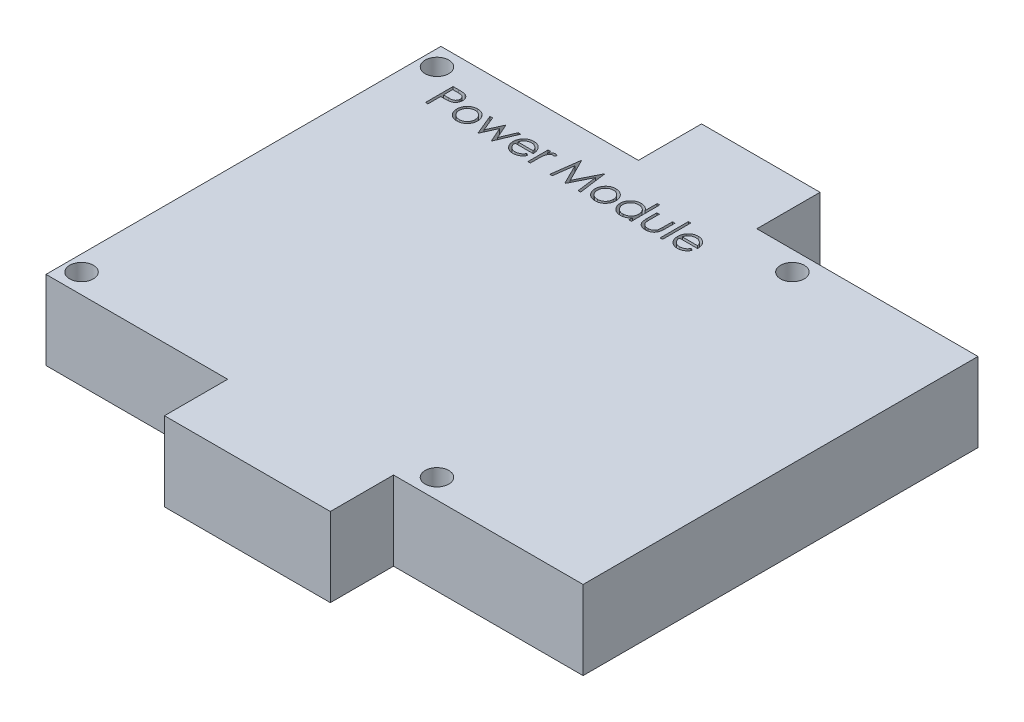
from build123d import *

# Parameters (mm, degrees)
SCHIZZO1_W                   = 68
SCHIZZO1_H                   = 50
ESTRUSIONE_ESTRUSIONE1_DEPTH = 10
SCHIZZO2_W                   = 0.314102564
SCHIZZO2_H                   = 3.589743589
TAGLIO_ESTRUSIONE1_DEPTH     = 3
SCHIZZO6_W                   = 21
SCHIZZO6_H                   = 10
ESTRUSIONE_ESTRUSIONE2_DEPTH = 8
SCHIZZO7_W                   = 15
SCHIZZO7_H                   = 10
ESTRUSIONE_ESTRUSIONE3_DEPTH = 8
SCHIZZO3_R                   = 1.5
TAGLIO_ESTRUSIONE2_DEPTH     = 49.42520019
SCHIZZO4_R                   = 1.5
TAGLIO_ESTRUSIONE3_DEPTH     = 49.42520019


with BuildPart() as part:
    # Schizzo1 → Estrusione-Estrusione1 (new body)
    with BuildSketch(Plane(origin=(0, 0, 0), x_dir=(1, 0, 0), z_dir=(0, 1, 0))):
        Rectangle(SCHIZZO1_W, SCHIZZO1_H)
    extrude(amount=ESTRUSIONE_ESTRUSIONE1_DEPTH)

    # Schizzo2 → Taglio-Estrusione1 (cut)
    # profile 1 of 11: a face of its own
    with BuildSketch(Plane(origin=(0, 10, 0), x_dir=(1, 0, 0), z_dir=(0, 1, 0))):
        with BuildLine():
            Line((-28.826759307, 21.36611206), (-28.14036107, 21.36611206))
            add(Edge.make_bspline(
                [(-28.14036107, 21.36611206), (-28.093150164, 21.366060163), (-28.002691971, 21.365960728), (-27.872976915, 21.362945982), (-27.755167184, 21.35891929), (-27.649516803, 21.353337397), (-27.555700705, 21.346740807), (-27.474143405, 21.337488767), (-27.404203849, 21.327828472), (-27.362297399, 21.318007065), (-27.343185589, 21.313527925)],
                knots=[0, 0, 0, 0, 1.415646017, 2.712440637, 3.8905458, 4.950247383, 5.884950622, 6.709939814, 7.411656543, 8, 8, 8, 8], degree=3))
            add(Edge.make_bspline(
                [(-27.343185589, 21.313527925), (-27.318992056, 21.306905975), (-27.271175078, 21.293818114), (-27.202274035, 21.26760439), (-27.13672019, 21.236522225), (-27.074288631, 21.201098285), (-27.015746548, 21.159812721), (-26.960220507, 21.114339103), (-26.908200527, 21.063627535), (-26.859979135, 21.008246795), (-26.815694337, 20.949126585), (-26.777564655, 20.885384355), (-26.745637428, 20.818093052), (-26.718254156, 20.74729948), (-26.698545702, 20.672409157), (-26.683698802, 20.593942445), (-26.674275174, 20.511907754), (-26.673372613, 20.455847887), (-26.672913153, 20.427309976)],
                knots=[0, 0, 0, 0, 0.999701418, 1.975846123, 2.934577507, 3.890451536, 4.834027766, 5.787354733, 6.749476667, 7.726910423, 8.712836071, 9.690891519, 10.682875813, 11.679750201, 12.712814741, 13.765529915, 14.8625177, 16, 16, 16, 16], degree=3))
            add(Edge.make_bspline(
                [(-26.672913153, 20.427309976), (-26.673334578, 20.3985322), (-26.674159124, 20.342226536), (-26.684055409, 20.259853747), (-26.697385601, 20.181135357), (-26.717882653, 20.106245907), (-26.744728326, 20.035630136), (-26.776220379, 19.968208904), (-26.81420391, 19.905129232), (-26.857848739, 19.846162115), (-26.906400334, 19.791252203), (-26.959653272, 19.740797408), (-27.017392564, 19.69509307), (-27.079434713, 19.654036726), (-27.146384561, 19.618580447), (-27.217226715, 19.586823142), (-27.292576931, 19.560152081), (-27.344719445, 19.54612202), (-27.371230461, 19.538988662)],
                knots=[0, 0, 0, 0, 1.121902311, 2.195077645, 3.232258892, 4.234102512, 5.217864754, 6.176164875, 7.132989551, 8.084763148, 9.034132444, 9.988522005, 10.94243251, 11.903244335, 12.886203696, 13.894208494, 14.929344452, 16, 16, 16, 16], degree=3))
            add(Edge.make_bspline(
                [(-27.371230461, 19.538988662), (-27.393157795, 19.534325681), (-27.441212822, 19.524106487), (-27.520355545, 19.51269803), (-27.612500931, 19.50296043), (-27.71752321, 19.495659292), (-27.835328115, 19.489408923), (-27.965979373, 19.48444083), (-28.10973345, 19.481710976), (-28.210004694, 19.481570183), (-28.262356262, 19.481496675)],
                knots=[0, 0, 0, 0, 0.601384939, 1.31797006, 2.144135048, 3.087295005, 4.142315834, 5.309527816, 6.595305764, 8, 8, 8, 8], degree=3))
            Line((-28.262356262, 19.481496675), (-28.512656743, 19.481496675))
            Line((-28.512656743, 19.481496675), (-28.512656743, 17.86611206))
            Line((-28.512656743, 17.86611206), (-28.826759307, 17.86611206))
            Line((-28.826759307, 17.86611206), (-28.826759307, 21.36611206))
        make_face()
        with BuildLine():
            Line((-28.512656743, 21.007137701), (-28.512656743, 19.840471034))
            Line((-28.512656743, 19.840471034), (-27.899876294, 19.832758694))
            add(Edge.make_bspline(
                [(-27.899876294, 19.832758694), (-27.869956369, 19.832743231), (-27.812196569, 19.832713379), (-27.728760345, 19.836698602), (-27.651351058, 19.841299135), (-27.580206483, 19.848035058), (-27.515294548, 19.857556316), (-27.456507019, 19.867168054), (-27.404299737, 19.881073416), (-27.343200535, 19.899796485), (-27.275117187, 19.931729101), (-27.201049639, 19.978078991), (-27.138279052, 20.037159699), (-27.083960756, 20.103587531), (-27.040854878, 20.17748666), (-27.009298885, 20.256555597), (-26.990757728, 20.339983446), (-26.988271534, 20.397071585), (-26.987015718, 20.425907733)],
                knots=[0, 0, 0, 0, 1.160613943, 2.240541288, 3.23993089, 4.169200891, 5.011653406, 5.7853311, 6.478053781, 7.106038997, 8.262395093, 9.384106736, 10.481365981, 11.59014053, 12.70357646, 13.786202915, 14.881775077, 16, 16, 16, 16], degree=3))
            add(Edge.make_bspline(
                [(-26.987015718, 20.425907733), (-26.988278364, 20.454046246), (-26.990788349, 20.509982128), (-27.009444212, 20.591960889), (-27.040793526, 20.670196593), (-27.084250121, 20.743169679), (-27.13699125, 20.809358483), (-27.198290594, 20.86685561), (-27.268003855, 20.913077313), (-27.332852086, 20.942910594), (-27.390453272, 20.96112587), (-27.440485232, 20.97387071), (-27.496975906, 20.984046316), (-27.559943686, 20.992285819), (-27.62890052, 20.99933928), (-27.704438835, 21.004125258), (-27.786272478, 21.006926714), (-27.843083049, 21.007065669), (-27.872532544, 21.007137701)],
                knots=[0, 0, 0, 0, 1.120700087, 2.227813068, 3.331159281, 4.466773991, 5.599788987, 6.693661531, 7.80175334, 8.91857717, 9.525282508, 10.207424825, 10.974604443, 11.810962634, 12.737642355, 13.736264703, 14.826523623, 16, 16, 16, 16], degree=3))
            Line((-27.872532544, 21.007137701), (-28.512656743, 21.007137701))
        make_face(mode=Mode.SUBTRACT)
    # profile 2 of 11: a face of its own
    with BuildSketch(Plane(origin=(0, 10, 0), x_dir=(1, 0, 0), z_dir=(0, 1, 0))):
        with BuildLine():
            add(Edge.make_bspline(
                [(-24.809331423, 20.468676162), (-24.76134015, 20.467654271), (-24.667240992, 20.465650592), (-24.529433106, 20.444235627), (-24.39788797, 20.411488262), (-24.272101778, 20.3662167), (-24.153685483, 20.30553475), (-24.040914239, 20.233125459), (-23.93409723, 20.147342865), (-23.870074201, 20.080984797), (-23.837576615, 20.047301964)],
                knots=[0, 0, 0, 0, 1.054011418, 2.066658804, 3.057071809, 4.030435133, 4.997543892, 5.974964718, 6.972108034, 8, 8, 8, 8], degree=3))
            add(Edge.make_bspline(
                [(-23.837576615, 20.047301964), (-23.809594661, 20.015087978), (-23.754172281, 19.951283436), (-23.683106562, 19.847827823), (-23.621885002, 19.740687722), (-23.572822041, 19.628440395), (-23.534137017, 19.512065724), (-23.506671321, 19.391163713), (-23.490334386, 19.266001366), (-23.488131419, 19.180997528), (-23.487015718, 19.137946996)],
                knots=[0, 0, 0, 0, 1.025258237, 2.030674902, 3.01204498, 3.988269485, 4.97094183, 5.956517959, 6.965070386, 8, 8, 8, 8], degree=3))
            add(Edge.make_bspline(
                [(-23.487015718, 19.137946996), (-23.487997055, 19.094646938), (-23.489936223, 19.009084005), (-23.50827984, 18.883064639), (-23.536810925, 18.760869816), (-23.577642764, 18.643011122), (-23.630000873, 18.529128295), (-23.69389156, 18.419718746), (-23.769763178, 18.314566612), (-23.855767174, 18.214564774), (-23.95081905, 18.122398559), (-24.053935199, 18.04207029), (-24.163089233, 17.973248765), (-24.279732586, 17.91781235), (-24.402800073, 17.87410265), (-24.532557141, 17.843402633), (-24.668802211, 17.824840949), (-24.761829432, 17.822457376), (-24.809331423, 17.821240265)],
                knots=[0, 0, 0, 0, 0.998656419, 1.973391657, 2.932242238, 3.890759089, 4.846373663, 5.82037756, 6.809684879, 7.83454468, 8.860553229, 9.859544525, 10.845671541, 11.83227036, 12.833544569, 13.85385346, 14.904124723, 16, 16, 16, 16], degree=3))
            add(Edge.make_bspline(
                [(-24.809331423, 17.821240265), (-24.857066142, 17.822461461), (-24.950557002, 17.824853236), (-25.087282984, 17.843330518), (-25.217272603, 17.874088501), (-25.340501201, 17.917955994), (-25.457646048, 17.973250537), (-25.567432545, 18.041862227), (-25.670632461, 18.122422382), (-25.765704445, 18.214558319), (-25.85170305, 18.314568276), (-25.927576059, 18.419718314), (-25.991466385, 18.529128407), (-26.043824589, 18.643011092), (-26.084656402, 18.760869824), (-26.113187494, 18.883064637), (-26.131531109, 19.009084005), (-26.133470278, 19.094646938), (-26.134451615, 19.137946996)],
                knots=[0, 0, 0, 0, 1.099876186, 2.154163076, 3.173186993, 4.173200201, 5.163417411, 6.152872554, 7.150605724, 8.17532212, 9.198891216, 10.186952605, 11.159729845, 12.11414092, 13.071450619, 14.029093627, 15.002601286, 16, 16, 16, 16], degree=3))
            add(Edge.make_bspline(
                [(-26.134451615, 19.137946996), (-26.133328305, 19.180763542), (-26.131104343, 19.265532944), (-26.114783834, 19.390460005), (-26.087425278, 19.511157394), (-26.048693881, 19.62708287), (-25.99917869, 19.738838306), (-25.938817402, 19.846243137), (-25.86702677, 19.949230937), (-25.811824818, 20.012953017), (-25.783890718, 20.045198598)],
                knots=[0, 0, 0, 0, 1.031353054, 2.041901799, 3.029428768, 4.008703097, 4.981709435, 5.96992636, 6.972712378, 8, 8, 8, 8], degree=3))
            add(Edge.make_bspline(
                [(-25.783890718, 20.045198598), (-25.751442127, 20.079173537), (-25.687626263, 20.145991234), (-25.580277535, 20.231523758), (-25.467783714, 20.305439832), (-25.348058788, 20.364916047), (-25.22237593, 20.411754565), (-25.090156687, 20.44432008), (-24.951881172, 20.465573435), (-24.857321551, 20.467631613), (-24.809331423, 20.468676162)],
                knots=[0, 0, 0, 0, 1.027980169, 2.021703884, 2.998553061, 3.971491411, 4.943284454, 5.930300938, 6.949603206, 8, 8, 8, 8], degree=3))
        make_face()
        with BuildLine():
            add(Edge.make_bspline(
                [(-24.810733666, 20.154573598), (-24.844671278, 20.153609007), (-24.911670406, 20.151704724), (-25.010289991, 20.137220819), (-25.105230145, 20.114273315), (-25.196670989, 20.081669259), (-25.284304161, 20.03957036), (-25.368213564, 19.987862), (-25.448646004, 19.927229043), (-25.524028067, 19.857766372), (-25.593210379, 19.781887377), (-25.653688356, 19.701039018), (-25.705113462, 19.616532672), (-25.747953621, 19.528280461), (-25.779860809, 19.435388047), (-25.803033832, 19.338907416), (-25.817504072, 19.238641999), (-25.819390451, 19.170480981), (-25.820349051, 19.13584363)],
                knots=[0, 0, 0, 0, 1.021534396, 2.016698045, 2.994645724, 3.958388632, 4.93408049, 5.916473867, 6.921342795, 7.962252576, 8.998418191, 10.008913653, 10.997312074, 11.973003931, 12.956656626, 13.948281152, 14.957379055, 16, 16, 16, 16], degree=3))
            add(Edge.make_bspline(
                [(-25.820349051, 19.13584363), (-25.818742227, 19.091091603), (-25.815552983, 19.002267198), (-25.789617746, 18.871456075), (-25.746231466, 18.745874223), (-25.687644187, 18.626257837), (-25.614237968, 18.515585559), (-25.527750901, 18.416914074), (-25.429111201, 18.331728263), (-25.319494701, 18.261047417), (-25.201140383, 18.204887662), (-25.075884062, 18.165088686), (-24.945243368, 18.139216994), (-24.855962637, 18.136645519), (-24.810733666, 18.135342829)],
                knots=[0, 0, 0, 0, 1.016792936, 2.018143844, 3.017858371, 4.030088057, 5.03801393, 6.028138512, 7.003788237, 7.991172063, 8.984598303, 9.972568034, 10.972917682, 12, 12, 12, 12], degree=3))
            add(Edge.make_bspline(
                [(-24.810733666, 18.135342829), (-24.765507297, 18.136653109), (-24.676231701, 18.139239566), (-24.545772525, 18.164958386), (-24.420858553, 18.205062047), (-24.302627165, 18.260984256), (-24.193060562, 18.331996671), (-24.09371144, 18.416433048), (-24.007962829, 18.5158469), (-23.934629224, 18.626404428), (-23.875082482, 18.74568878), (-23.83189928, 18.871479253), (-23.805901694, 19.002261295), (-23.802720865, 19.091089625), (-23.801118282, 19.13584363)],
                knots=[0, 0, 0, 0, 1.02726834, 2.027799167, 3.010890988, 4.004497153, 4.992059811, 5.971914811, 6.958719428, 7.966827853, 8.981595046, 9.981490638, 10.983022906, 12, 12, 12, 12], degree=3))
            add(Edge.make_bspline(
                [(-23.801118282, 19.13584363), (-23.802076552, 19.170481188), (-23.803962281, 19.238642614), (-23.818437245, 19.338905067), (-23.841592785, 19.435396664), (-23.873564402, 19.528248667), (-23.916218416, 19.616761171), (-23.968635209, 19.700790899), (-24.028866234, 19.782167445), (-24.098883355, 19.857521085), (-24.174186733, 19.927256122), (-24.254651771, 19.987885511), (-24.33843675, 20.039343107), (-24.425815333, 20.082029347), (-24.5172679, 20.113976688), (-24.612075029, 20.137353319), (-24.710273839, 20.151643516), (-24.777032883, 20.153590657), (-24.810733666, 20.154573598)],
                knots=[0, 0, 0, 0, 1.042956736, 2.052379634, 3.044323526, 4.02829302, 5.004299113, 5.996692471, 7.007513377, 8.048758398, 9.090003419, 10.095195979, 11.07790575, 12.047570684, 13.018257071, 13.989683339, 14.985167495, 16, 16, 16, 16], degree=3))
        make_face(mode=Mode.SUBTRACT)
    # profile 3 of 11: a face of its own
    with BuildSketch(Plane(origin=(0, 10, 0), x_dir=(1, 0, 0), z_dir=(0, 1, 0))):
        Polygon((-23.217784948, 20.423804367), (-22.880545365, 20.423804367), (-22.118425974, 18.584060778), (-21.283389916, 20.423804367), (-21.23010466, 20.423804367), (-20.413297769, 18.584060778), (-19.64416716, 20.423804367), (-19.313938794, 20.423804367), (-20.383149532, 17.86611206), (-20.448353859, 17.86611206), (-21.265861871, 19.705855649), (-22.100196807, 17.86611206), (-22.158389916, 17.86611206), align=None)
    # profile 4 of 11: a face of its own
    with BuildSketch(Plane(origin=(0, 10, 0), x_dir=(1, 0, 0), z_dir=(0, 1, 0))):
        with BuildLine():
            Line((-16.810933987, 18.673804367), (-16.531887512, 18.527269912))
            add(Edge.make_bspline(
                [(-16.531887512, 18.527269912), (-16.554124108, 18.487826581), (-16.597387716, 18.411085478), (-16.671788464, 18.305653618), (-16.749780537, 18.210805902), (-16.834884505, 18.129076248), (-16.924554184, 18.057824863), (-17.019286838, 17.995487038), (-17.119575656, 17.942368518), (-17.225425381, 17.89761599), (-17.337724932, 17.863206496), (-17.456746448, 17.838902275), (-17.582717944, 17.823879006), (-17.669064124, 17.822133865), (-17.713277737, 17.821240265)],
                knots=[0, 0, 0, 0, 1.120438281, 2.179929193, 3.190490725, 4.156257408, 5.095198341, 6.022838206, 6.959905092, 7.901321166, 8.864066838, 9.862729781, 10.905609505, 12, 12, 12, 12], degree=3))
            add(Edge.make_bspline(
                [(-17.713277737, 17.821240265), (-17.762419714, 17.82238744), (-17.858281476, 17.824625247), (-17.997821223, 17.843917711), (-18.129200641, 17.87539007), (-18.252412345, 17.919355612), (-18.367154597, 17.976782936), (-18.473655452, 18.046742417), (-18.572474978, 18.128874672), (-18.660499187, 18.223891116), (-18.73974307, 18.325573073), (-18.80966889, 18.431528957), (-18.868126321, 18.541492182), (-18.915678931, 18.654762706), (-18.954083796, 18.770626599), (-18.9808505, 18.890138067), (-18.996280248, 19.012973651), (-18.998644693, 19.096070987), (-18.99983623, 19.137946996)],
                knots=[0, 0, 0, 0, 1.145258523, 2.234067595, 3.276747158, 4.290159414, 5.277019952, 6.260822364, 7.254936242, 8.264827045, 9.274100331, 10.257902744, 11.220704747, 12.172965371, 13.118907548, 14.062713208, 15.023725156, 16, 16, 16, 16], degree=3))
            add(Edge.make_bspline(
                [(-18.99983623, 19.137946996), (-18.998777089, 19.177241826), (-18.996678011, 19.255118991), (-18.983447223, 19.370384535), (-18.95999893, 19.482412988), (-18.927822606, 19.591297436), (-18.88627136, 19.69685557), (-18.835439141, 19.799151633), (-18.775246763, 19.898076773), (-18.728774089, 19.960479907), (-18.705365077, 19.991913342)],
                knots=[0, 0, 0, 0, 1.024358464, 2.0301432, 3.019427413, 4.004406732, 4.986367066, 5.972626655, 6.978780325, 8, 8, 8, 8], degree=3))
            add(Edge.make_bspline(
                [(-18.705365077, 19.991913342), (-18.673657394, 20.029782212), (-18.611246447, 20.104320362), (-18.505690092, 20.202258688), (-18.391389895, 20.284302463), (-18.269778269, 20.352309599), (-18.139441795, 20.403983246), (-18.002132504, 20.442490829), (-17.856286918, 20.46406884), (-17.756581697, 20.467116673), (-17.705565397, 20.468676162)],
                knots=[0, 0, 0, 0, 1.030682036, 2.02871468, 2.997146059, 3.962720338, 4.930598197, 5.918074684, 6.934738563, 8, 8, 8, 8], degree=3))
            add(Edge.make_bspline(
                [(-17.705565397, 20.468676162), (-17.653117792, 20.467322113), (-17.550227546, 20.464665778), (-17.400195425, 20.440039445), (-17.258234708, 20.40098689), (-17.124402204, 20.3458331), (-16.998684343, 20.274673548), (-16.881898294, 20.186531706), (-16.772046781, 20.084113619), (-16.708138202, 20.00535041), (-16.67561748, 19.965270714)],
                knots=[0, 0, 0, 0, 1.056321875, 2.072262726, 3.055038591, 4.01806755, 4.982017516, 5.957941055, 6.960871419, 8, 8, 8, 8], degree=3))
            add(Edge.make_bspline(
                [(-16.67561748, 19.965270714), (-16.653490542, 19.935067132), (-16.609383949, 19.874861014), (-16.554136849, 19.776689856), (-16.506179454, 19.673979262), (-16.467846493, 19.565068965), (-16.436806992, 19.451249385), (-16.414350173, 19.33170684), (-16.401180554, 19.206476929), (-16.398591857, 19.121150373), (-16.397272128, 19.077650521)],
                knots=[0, 0, 0, 0, 0.94817472, 1.890038105, 2.849395472, 3.817997239, 4.812318967, 5.836947057, 6.897266129, 8, 8, 8, 8], degree=3))
            Line((-16.397272128, 19.077650521), (-18.685733666, 19.077650521))
            add(Edge.make_bspline(
                [(-18.685733666, 19.077650521), (-18.68419406, 19.043950057), (-18.681166486, 18.977679453), (-18.667051343, 18.88070867), (-18.644802569, 18.788335328), (-18.613533506, 18.701252286), (-18.575666661, 18.618322159), (-18.529280944, 18.540160122), (-18.47394139, 18.467122192), (-18.412215691, 18.398555054), (-18.343508596, 18.337494293), (-18.271225848, 18.282842517), (-18.194332283, 18.23703692), (-18.1134342, 18.19985703), (-18.028662415, 18.170750714), (-17.93999022, 18.150882893), (-17.847592103, 18.137575786), (-17.784606369, 18.136096121), (-17.752540557, 18.135342829)],
                knots=[0, 0, 0, 0, 1.094153842, 2.151609401, 3.174256925, 4.172055639, 5.149267565, 6.128595816, 7.11444997, 8.118368179, 9.117203808, 10.09244225, 11.054858984, 12.015122123, 12.976791628, 13.957293641, 14.960065497, 16, 16, 16, 16], degree=3))
            add(Edge.make_bspline(
                [(-17.752540557, 18.135342829), (-17.72118941, 18.135950886), (-17.658982719, 18.137157387), (-17.566341861, 18.148889298), (-17.475202334, 18.167859573), (-17.385941351, 18.193749563), (-17.300370505, 18.225326415), (-17.221124955, 18.263429273), (-17.148244739, 18.30557902), (-17.080127773, 18.353788695), (-17.014056779, 18.412796882), (-16.948514293, 18.486432603), (-16.878237639, 18.573520131), (-16.834248047, 18.639065797), (-16.810933987, 18.673804367)],
                knots=[0, 0, 0, 0, 0.99110716, 1.966546729, 2.947904876, 3.932708344, 4.903319531, 5.828989031, 6.710028674, 7.56322171, 8.463672341, 9.504779593, 10.677557249, 12, 12, 12, 12], degree=3))
        make_face()
        with BuildLine():
            add(Edge.make_bspline(
                [(-16.711374692, 19.391753085), (-16.722871316, 19.433415959), (-16.744998618, 19.51360358), (-16.791234982, 19.62464447), (-16.843306523, 19.723332371), (-16.904928254, 19.808912004), (-16.97474698, 19.884915517), (-17.055392163, 19.951334102), (-17.145828056, 20.010751553), (-17.245587197, 20.060904053), (-17.351228982, 20.103593912), (-17.461835174, 20.132219027), (-17.574692962, 20.15182857), (-17.651027248, 20.153654678), (-17.689439596, 20.154573598)],
                knots=[0, 0, 0, 0, 1.154881502, 2.222775134, 3.210006277, 4.132804581, 5.035138423, 5.962687519, 6.919655026, 7.923214229, 8.944639381, 9.960483929, 10.97369054, 12, 12, 12, 12], degree=3))
            add(Edge.make_bspline(
                [(-17.689439596, 20.154573598), (-17.720789034, 20.153961927), (-17.782760283, 20.152752781), (-17.874061351, 20.141282651), (-17.96174105, 20.122322806), (-18.046446338, 20.09635785), (-18.127067206, 20.061749247), (-18.205261975, 20.021166021), (-18.279042371, 19.971624437), (-18.325183666, 19.933865582), (-18.348494083, 19.914789944)],
                knots=[0, 0, 0, 0, 1.04873581, 2.073130211, 3.073294108, 4.04793562, 5.032784715, 6.005352987, 6.992311501, 8, 8, 8, 8], degree=3))
            add(Edge.make_bspline(
                [(-18.348494083, 19.914789944), (-18.365187365, 19.899695629), (-18.398970499, 19.869148413), (-18.444111021, 19.816519206), (-18.487331493, 19.759767644), (-18.526665146, 19.696722519), (-18.562742732, 19.62810174), (-18.59650271, 19.554484105), (-18.626889122, 19.475310975), (-18.643985232, 19.420138536), (-18.652780942, 19.391753085)],
                knots=[0, 0, 0, 0, 0.879870761, 1.780643979, 2.707998968, 3.669668524, 4.684282772, 5.740141944, 6.837334558, 8, 8, 8, 8], degree=3))
            Line((-18.652780942, 19.391753085), (-16.711374692, 19.391753085))
        make_face(mode=Mode.SUBTRACT)
    # profile 5 of 11: a face of its own
    with BuildSketch(Plane(origin=(0, 10, 0), x_dir=(1, 0, 0), z_dir=(0, 1, 0))):
        with BuildLine():
            Line((-15.858810589, 20.423804367), (-15.544708025, 20.423804367))
            Line((-15.544708025, 20.423804367), (-15.544708025, 20.047301964))
            add(Edge.make_bspline(
                [(-15.544708025, 20.047301964), (-15.521519266, 20.082357792), (-15.477170946, 20.149401791), (-15.403458016, 20.238071092), (-15.327954685, 20.311486139), (-15.250299498, 20.369989658), (-15.169921398, 20.413802776), (-15.088584446, 20.445895811), (-15.005008976, 20.464873127), (-14.948847052, 20.467406786), (-14.920709628, 20.468676162)],
                knots=[0, 0, 0, 0, 1.2804753, 2.448899062, 3.506932113, 4.484331642, 5.4025378, 6.288909075, 7.142734305, 8, 8, 8, 8], degree=3))
            add(Edge.make_bspline(
                [(-14.920709628, 20.468676162), (-14.898883301, 20.467485636), (-14.853974216, 20.46503605), (-14.785991626, 20.447825225), (-14.715948174, 20.420347203), (-14.670805787, 20.39450698), (-14.647272128, 20.381035938)],
                knots=[0, 0, 0, 0, 0.901110191, 1.854092781, 2.881294221, 4, 4, 4, 4], degree=3))
            Line((-14.647272128, 20.381035938), (-14.819748089, 20.109000682))
            add(Edge.make_bspline(
                [(-14.819748089, 20.109000682), (-14.83485711, 20.115740948), (-14.863536925, 20.128535263), (-14.905491491, 20.143677273), (-14.944172828, 20.152593189), (-14.968816386, 20.153943906), (-14.98030498, 20.154573598)],
                knots=[0, 0, 0, 0, 1.180555205, 2.24091978, 3.179933427, 4, 4, 4, 4], degree=3))
            add(Edge.make_bspline(
                [(-14.98030498, 20.154573598), (-15.005510714, 20.152893561), (-15.056923104, 20.149466772), (-15.132407603, 20.122527964), (-15.205654809, 20.079002724), (-15.263826471, 20.030731612), (-15.308868724, 19.984183814), (-15.341008949, 19.943535412), (-15.370491696, 19.89795678), (-15.398661917, 19.848227096), (-15.424328211, 19.79349725), (-15.44828288, 19.734314037), (-15.469941743, 19.670608908), (-15.482291987, 19.626226388), (-15.488618282, 19.603491867)],
                knots=[0, 0, 0, 0, 1.125678352, 2.296057538, 3.5422874, 4.923748041, 5.663163013, 6.437101912, 7.23742474, 8.08941207, 8.991984279, 9.93940061, 10.944477711, 12, 12, 12, 12], degree=3))
            add(Edge.make_bspline(
                [(-15.488618282, 19.603491867), (-15.493350675, 19.583214694), (-15.503832567, 19.538302295), (-15.514024105, 19.46295377), (-15.524093623, 19.373930112), (-15.531190241, 19.270983519), (-15.537768283, 19.154371075), (-15.541478365, 19.023915129), (-15.544581506, 18.879481778), (-15.544664573, 18.778507425), (-15.544708025, 18.72568738)],
                knots=[0, 0, 0, 0, 0.566838948, 1.255505196, 2.06880316, 3.007127437, 4.065329342, 5.249902469, 6.561414163, 8, 8, 8, 8], degree=3))
            Line((-15.544708025, 18.72568738), (-15.544708025, 17.86611206))
            Line((-15.544708025, 17.86611206), (-15.858810589, 17.86611206))
            Line((-15.858810589, 17.86611206), (-15.858810589, 20.423804367))
        make_face()
    # profile 6 of 11: a face of its own
    with BuildSketch(Plane(origin=(0, 10, 0), x_dir=(1, 0, 0), z_dir=(0, 1, 0))):
        Polygon((-13.076759307, 17.86611206), (-12.614720044, 21.36611206), (-12.56984825, 21.36611206), (-11.12483623, 18.494317188), (-9.68332982, 21.36611206), (-9.637756903, 21.36611206), (-9.172913153, 17.86611206), (-9.488417961, 17.86611206), (-9.823554179, 20.384541547), (-11.086975653, 17.86611206), (-11.157788955, 17.86611206), (-12.426118282, 20.390150521), (-12.760553378, 17.86611206), align=None)
    # profile 7 of 11: a face of its own
    with BuildSketch(Plane(origin=(0, 10, 0), x_dir=(1, 0, 0), z_dir=(0, 1, 0))):
        with BuildLine():
            add(Edge.make_bspline(
                [(-7.309331423, 20.468676162), (-7.26134015, 20.467654271), (-7.167240992, 20.465650592), (-7.029433106, 20.444235627), (-6.89788797, 20.411488262), (-6.772101778, 20.3662167), (-6.653685483, 20.30553475), (-6.540914239, 20.233125459), (-6.43409723, 20.147342865), (-6.370074201, 20.080984797), (-6.337576615, 20.047301964)],
                knots=[0, 0, 0, 0, 1.054011418, 2.066658804, 3.057071809, 4.030435133, 4.997543892, 5.974964718, 6.972108034, 8, 8, 8, 8], degree=3))
            add(Edge.make_bspline(
                [(-6.337576615, 20.047301964), (-6.309594661, 20.015087978), (-6.254172281, 19.951283436), (-6.183106562, 19.847827823), (-6.121885002, 19.740687722), (-6.072822041, 19.628440395), (-6.034137017, 19.512065724), (-6.006671321, 19.391163713), (-5.990334386, 19.266001366), (-5.988131419, 19.180997528), (-5.987015718, 19.137946996)],
                knots=[0, 0, 0, 0, 1.025258237, 2.030674902, 3.01204498, 3.988269485, 4.97094183, 5.956517959, 6.965070386, 8, 8, 8, 8], degree=3))
            add(Edge.make_bspline(
                [(-5.987015718, 19.137946996), (-5.987997055, 19.094646938), (-5.989936223, 19.009084005), (-6.00827984, 18.883064639), (-6.036810925, 18.760869816), (-6.077642764, 18.643011122), (-6.130000873, 18.529128295), (-6.19389156, 18.419718746), (-6.269763178, 18.314566612), (-6.355767174, 18.214564774), (-6.45081905, 18.122398559), (-6.553935199, 18.04207029), (-6.663089233, 17.973248765), (-6.779732586, 17.91781235), (-6.902800073, 17.87410265), (-7.032557141, 17.843402633), (-7.168802211, 17.824840949), (-7.261829432, 17.822457376), (-7.309331423, 17.821240265)],
                knots=[0, 0, 0, 0, 0.998656419, 1.973391657, 2.932242238, 3.890759089, 4.846373663, 5.82037756, 6.809684879, 7.83454468, 8.860553229, 9.859544525, 10.845671541, 11.83227036, 12.833544569, 13.85385346, 14.904124723, 16, 16, 16, 16], degree=3))
            add(Edge.make_bspline(
                [(-7.309331423, 17.821240265), (-7.357066142, 17.822461461), (-7.450557002, 17.824853236), (-7.587282984, 17.843330518), (-7.717272603, 17.874088501), (-7.840501201, 17.917955994), (-7.957646048, 17.973250537), (-8.067432545, 18.041862227), (-8.170632461, 18.122422382), (-8.265704445, 18.214558319), (-8.35170305, 18.314568276), (-8.427576059, 18.419718314), (-8.491466385, 18.529128407), (-8.543824589, 18.643011092), (-8.584656402, 18.760869824), (-8.613187494, 18.883064637), (-8.631531109, 19.009084005), (-8.633470278, 19.094646938), (-8.634451615, 19.137946996)],
                knots=[0, 0, 0, 0, 1.099876186, 2.154163076, 3.173186993, 4.173200201, 5.163417411, 6.152872554, 7.150605724, 8.17532212, 9.198891216, 10.186952605, 11.159729845, 12.11414092, 13.071450619, 14.029093627, 15.002601286, 16, 16, 16, 16], degree=3))
            add(Edge.make_bspline(
                [(-8.634451615, 19.137946996), (-8.633328305, 19.180763542), (-8.631104343, 19.265532944), (-8.614783834, 19.390460005), (-8.587425278, 19.511157394), (-8.548693881, 19.62708287), (-8.49917869, 19.738838306), (-8.438817402, 19.846243137), (-8.36702677, 19.949230937), (-8.311824818, 20.012953017), (-8.283890718, 20.045198598)],
                knots=[0, 0, 0, 0, 1.031353054, 2.041901799, 3.029428768, 4.008703097, 4.981709435, 5.96992636, 6.972712378, 8, 8, 8, 8], degree=3))
            add(Edge.make_bspline(
                [(-8.283890718, 20.045198598), (-8.251442127, 20.079173537), (-8.187626263, 20.145991234), (-8.080277535, 20.231523758), (-7.967783714, 20.305439832), (-7.848058788, 20.364916047), (-7.72237593, 20.411754565), (-7.590156687, 20.44432008), (-7.451881172, 20.465573435), (-7.357321551, 20.467631613), (-7.309331423, 20.468676162)],
                knots=[0, 0, 0, 0, 1.027980169, 2.021703884, 2.998553061, 3.971491411, 4.943284454, 5.930300938, 6.949603206, 8, 8, 8, 8], degree=3))
        make_face()
        with BuildLine():
            add(Edge.make_bspline(
                [(-7.310733666, 20.154573598), (-7.344671278, 20.153609007), (-7.411670406, 20.151704724), (-7.510289991, 20.137220819), (-7.605230145, 20.114273315), (-7.696670989, 20.081669259), (-7.784304161, 20.03957036), (-7.868213564, 19.987862), (-7.948646004, 19.927229043), (-8.024028067, 19.857766372), (-8.093210379, 19.781887377), (-8.153688356, 19.701039018), (-8.205113462, 19.616532672), (-8.247953621, 19.528280461), (-8.279860809, 19.435388047), (-8.303033832, 19.338907416), (-8.317504072, 19.238641999), (-8.319390451, 19.170480981), (-8.320349051, 19.13584363)],
                knots=[0, 0, 0, 0, 1.021534396, 2.016698045, 2.994645724, 3.958388632, 4.93408049, 5.916473867, 6.921342795, 7.962252576, 8.998418191, 10.008913653, 10.997312074, 11.973003931, 12.956656626, 13.948281152, 14.957379055, 16, 16, 16, 16], degree=3))
            add(Edge.make_bspline(
                [(-8.320349051, 19.13584363), (-8.318742227, 19.091091603), (-8.315552983, 19.002267198), (-8.289617746, 18.871456075), (-8.246231466, 18.745874223), (-8.187644187, 18.626257837), (-8.114237968, 18.515585559), (-8.027750901, 18.416914074), (-7.929111201, 18.331728263), (-7.819494701, 18.261047417), (-7.701140383, 18.204887662), (-7.575884062, 18.165088686), (-7.445243368, 18.139216994), (-7.355962637, 18.136645519), (-7.310733666, 18.135342829)],
                knots=[0, 0, 0, 0, 1.016792936, 2.018143844, 3.017858371, 4.030088057, 5.03801393, 6.028138512, 7.003788237, 7.991172063, 8.984598303, 9.972568034, 10.972917682, 12, 12, 12, 12], degree=3))
            add(Edge.make_bspline(
                [(-7.310733666, 18.135342829), (-7.265507297, 18.136653109), (-7.176231701, 18.139239566), (-7.045772525, 18.164958386), (-6.920858553, 18.205062047), (-6.802627165, 18.260984256), (-6.693060562, 18.331996671), (-6.59371144, 18.416433048), (-6.507962829, 18.5158469), (-6.434629224, 18.626404428), (-6.375082482, 18.74568878), (-6.33189928, 18.871479253), (-6.305901694, 19.002261295), (-6.302720865, 19.091089625), (-6.301118282, 19.13584363)],
                knots=[0, 0, 0, 0, 1.02726834, 2.027799167, 3.010890988, 4.004497153, 4.992059811, 5.971914811, 6.958719428, 7.966827853, 8.981595046, 9.981490638, 10.983022906, 12, 12, 12, 12], degree=3))
            add(Edge.make_bspline(
                [(-6.301118282, 19.13584363), (-6.302076552, 19.170481188), (-6.303962281, 19.238642614), (-6.318437245, 19.338905067), (-6.341592785, 19.435396664), (-6.373564402, 19.528248667), (-6.416218416, 19.616761171), (-6.468635209, 19.700790899), (-6.528866234, 19.782167445), (-6.598883355, 19.857521085), (-6.674186733, 19.927256122), (-6.754651771, 19.987885511), (-6.83843675, 20.039343107), (-6.925815333, 20.082029347), (-7.0172679, 20.113976688), (-7.112075029, 20.137353319), (-7.210273839, 20.151643516), (-7.277032883, 20.153590657), (-7.310733666, 20.154573598)],
                knots=[0, 0, 0, 0, 1.042956736, 2.052379634, 3.044323526, 4.02829302, 5.004299113, 5.996692471, 7.007513377, 8.048758398, 9.090003419, 10.095195979, 11.07790575, 12.047570684, 13.018257071, 13.989683339, 14.985167495, 16, 16, 16, 16], degree=3))
        make_face(mode=Mode.SUBTRACT)
    # profile 8 of 11: a face of its own
    with BuildSketch(Plane(origin=(0, 10, 0), x_dir=(1, 0, 0), z_dir=(0, 1, 0))):
        with BuildLine():
            Line((-2.756246487, 21.455855649), (-2.756246487, 17.86611206))
            Line((-2.756246487, 17.86611206), (-3.070349051, 17.86611206))
            Line((-3.070349051, 17.86611206), (-3.070349051, 18.308519912))
            add(Edge.make_bspline(
                [(-3.070349051, 18.308519912), (-3.105767841, 18.268480318), (-3.174888057, 18.190342547), (-3.290329175, 18.088260375), (-3.412697353, 18.003882053), (-3.541398674, 17.935732138), (-3.676316917, 17.884540081), (-3.817153004, 17.848153922), (-3.963964385, 17.824760087), (-4.06421674, 17.822424065), (-4.115020525, 17.821240265)],
                knots=[0, 0, 0, 0, 1.074387032, 2.096679803, 3.090159297, 4.057316773, 5.018401886, 5.985159533, 6.978961417, 8, 8, 8, 8], degree=3))
            add(Edge.make_bspline(
                [(-4.115020525, 17.821240265), (-4.160188479, 17.822466637), (-4.249261684, 17.824885098), (-4.380290761, 17.843647401), (-4.506383011, 17.873778023), (-4.627657583, 17.915678912), (-4.743329729, 17.971259734), (-4.854389825, 18.037800982), (-4.960262517, 18.117041812), (-5.059334056, 18.20762984), (-5.150566057, 18.306024828), (-5.230627329, 18.410970374), (-5.297380409, 18.522012678), (-5.35320049, 18.637745832), (-5.396196834, 18.759060752), (-5.426170469, 18.88553792), (-5.444910915, 19.017027793), (-5.447328376, 19.106567316), (-5.448554179, 19.151969432)],
                knots=[0, 0, 0, 0, 1.033919861, 2.038935746, 3.024066025, 3.998881131, 4.97069526, 5.957263378, 6.95902576, 7.993208707, 9.027059324, 10.027763471, 11.009749337, 11.988697705, 12.965288445, 13.950418724, 14.960734635, 16, 16, 16, 16], degree=3))
            add(Edge.make_bspline(
                [(-5.448554179, 19.151969432), (-5.447301208, 19.196433135), (-5.444824151, 19.284335478), (-5.426370931, 19.413614176), (-5.395339922, 19.538132437), (-5.351792075, 19.65748938), (-5.29595012, 19.771829431), (-5.228022033, 19.881233456), (-5.148002908, 19.986002853), (-5.055750501, 20.08367408), (-4.955815731, 20.173894694), (-4.848907, 20.25230374), (-4.737683719, 20.320020588), (-4.620420708, 20.373674065), (-4.498853603, 20.417083169), (-4.371900158, 20.447116137), (-4.240088579, 20.464813459), (-4.150598087, 20.467376223), (-4.10520482, 20.468676162)],
                knots=[0, 0, 0, 0, 1.020392517, 2.01726096, 2.990465484, 3.961182959, 4.928053699, 5.906110375, 6.912531644, 7.948652711, 8.985773172, 9.998621852, 10.987621588, 11.969261332, 12.953316658, 13.946091881, 14.958173133, 16, 16, 16, 16], degree=3))
            add(Edge.make_bspline(
                [(-4.10520482, 20.468676162), (-4.052988012, 20.467109066), (-3.950492222, 20.464033031), (-3.8005937, 20.438326664), (-3.65880609, 20.395163786), (-3.524313102, 20.336072505), (-3.397916542, 20.259271753), (-3.278689901, 20.166520306), (-3.168706578, 20.05519316), (-3.103634756, 19.971581586), (-3.070349051, 19.92881238)],
                knots=[0, 0, 0, 0, 1.031072012, 2.023879775, 2.993683497, 3.952812103, 4.918022106, 5.908088563, 6.929940113, 8, 8, 8, 8], degree=3))
            Line((-3.070349051, 19.92881238), (-3.070349051, 21.455855649))
            Line((-3.070349051, 21.455855649), (-2.756246487, 21.455855649))
        make_face()
        with BuildLine():
            add(Edge.make_bspline(
                [(-4.100998089, 20.154573598), (-4.146912427, 20.15293996), (-4.237540027, 20.149715419), (-4.370584029, 20.124541924), (-4.497897443, 20.08265733), (-4.618843518, 20.025375429), (-4.731511734, 19.953346692), (-4.832205405, 19.866225309), (-4.921748106, 19.766388295), (-4.997056371, 19.654286184), (-5.058446868, 19.534108093), (-5.101613899, 19.408483655), (-5.130083147, 19.279678678), (-5.132991667, 19.192315992), (-5.134451615, 19.148463823)],
                knots=[0, 0, 0, 0, 1.031046209, 2.035121221, 3.029706178, 4.034933723, 5.034054252, 6.02443088, 7.017295772, 8.038157696, 9.050218397, 10.03989886, 11.016116709, 12, 12, 12, 12], degree=3))
            add(Edge.make_bspline(
                [(-5.134451615, 19.148463823), (-5.132586722, 19.104873715), (-5.128864245, 19.01786436), (-5.10211355, 18.888883783), (-5.057233677, 18.763229741), (-4.995991614, 18.641968747), (-4.919304989, 18.529384647), (-4.830416337, 18.427644524), (-4.728466056, 18.340154936), (-4.615538549, 18.266917362), (-4.494930578, 18.207754841), (-4.368096647, 18.166589202), (-4.237421009, 18.140011421), (-4.148568675, 18.136906944), (-4.103802577, 18.135342829)],
                knots=[0, 0, 0, 0, 0.979072187, 1.954306742, 2.945804271, 3.96968567, 4.997920485, 5.998718438, 6.996577872, 8.005894225, 9.015743152, 10.005417472, 10.995077863, 12, 12, 12, 12], degree=3))
            add(Edge.make_bspline(
                [(-4.103802577, 18.135342829), (-4.058356074, 18.137002793), (-3.967967487, 18.140304297), (-3.834528779, 18.165585562), (-3.705033817, 18.20735436), (-3.581246588, 18.265253487), (-3.465930457, 18.337010843), (-3.362432579, 18.421017934), (-3.274916611, 18.518721118), (-3.200724001, 18.626097571), (-3.142548585, 18.743809567), (-3.100172526, 18.869143758), (-3.07511862, 19.002104506), (-3.07196089, 19.092968433), (-3.070349051, 19.139349239)],
                knots=[0, 0, 0, 0, 1.01762866, 2.023962475, 3.030623092, 4.058876274, 5.077231937, 6.066672613, 7.034107872, 8.005628644, 8.981990164, 9.965428785, 10.961468474, 12, 12, 12, 12], degree=3))
            add(Edge.make_bspline(
                [(-3.070349051, 19.139349239), (-3.071308707, 19.17468707), (-3.073197615, 19.244243103), (-3.087628184, 19.346370621), (-3.110583111, 19.444104347), (-3.142929281, 19.537547036), (-3.185420565, 19.626182051), (-3.236668331, 19.710645811), (-3.297573781, 19.790499023), (-3.367156477, 19.864642094), (-3.443321679, 19.932268556), (-3.52391622, 19.992632797), (-3.609894967, 20.042221569), (-3.699812004, 20.083262841), (-3.793823338, 20.115921991), (-3.892693958, 20.137709685), (-3.995372945, 20.152670006), (-4.065419, 20.153932386), (-4.100998089, 20.154573598)],
                knots=[0, 0, 0, 0, 1.050140795, 2.067009409, 3.05949893, 4.030605086, 5.00011959, 5.97591094, 6.962425594, 7.979863591, 8.993523472, 9.986985069, 10.967611495, 11.937549037, 12.921786183, 13.919465291, 14.943216303, 16, 16, 16, 16], degree=3))
        make_face(mode=Mode.SUBTRACT)
    # profile 9 of 11: a face of its own
    with BuildSketch(Plane(origin=(0, 10, 0), x_dir=(1, 0, 0), z_dir=(0, 1, 0))):
        with BuildLine():
            Line((-2.083169564, 20.423804367), (-1.769067, 20.423804367))
            Line((-1.769067, 20.423804367), (-1.769067, 19.237506291))
            add(Edge.make_bspline(
                [(-1.769067, 19.237506291), (-1.768925095, 19.202683541), (-1.768653637, 19.136069253), (-1.766812696, 19.040214067), (-1.762482603, 18.952797354), (-1.757068778, 18.873768617), (-1.750106642, 18.803141226), (-1.741823282, 18.741161868), (-1.73256486, 18.687127684), (-1.723502146, 18.654584329), (-1.719287352, 18.639449399)],
                knots=[0, 0, 0, 0, 1.388932606, 2.656963016, 3.823490214, 4.879454478, 5.816252168, 6.653371382, 7.373723809, 8, 8, 8, 8], degree=3))
            add(Edge.make_bspline(
                [(-1.719287352, 18.639449399), (-1.712525897, 18.620426529), (-1.699143556, 18.582776267), (-1.674870072, 18.528387262), (-1.644841736, 18.47801198), (-1.611981908, 18.429707907), (-1.5740825, 18.38490592), (-1.531623029, 18.343681677), (-1.486024792, 18.304477585), (-1.418269769, 18.258092793), (-1.325610503, 18.208377463), (-1.203957747, 18.165481645), (-1.072053522, 18.139845825), (-0.980888802, 18.13687157), (-0.934030942, 18.135342829)],
                knots=[0, 0, 0, 0, 0.725840625, 1.436591201, 2.137033971, 2.831655856, 3.53531722, 4.242432219, 4.957935707, 5.694543706, 7.190802206, 8.724350549, 10.316345118, 12, 12, 12, 12], degree=3))
            add(Edge.make_bspline(
                [(-0.934030942, 18.135342829), (-0.887177434, 18.136904078), (-0.796524566, 18.139924805), (-0.666069597, 18.164708343), (-0.546818182, 18.206114032), (-0.439967231, 18.263921444), (-0.346001391, 18.334663507), (-0.267696972, 18.417672316), (-0.203089717, 18.510321703), (-0.174880297, 18.579445981), (-0.160693602, 18.614209015)],
                knots=[0, 0, 0, 0, 1.157059328, 2.238695713, 3.266970494, 4.264342957, 5.228770407, 6.160125903, 7.074715775, 8, 8, 8, 8], degree=3))
            add(Edge.make_bspline(
                [(-0.160693602, 18.614209015), (-0.156499372, 18.628175314), (-0.147226954, 18.659051389), (-0.137264602, 18.711431137), (-0.128290141, 18.773895742), (-0.120626964, 18.846853951), (-0.115161802, 18.930115103), (-0.112215775, 19.023653179), (-0.1088875, 19.127174539), (-0.108836984, 19.199642299), (-0.108810589, 19.237506291)],
                knots=[0, 0, 0, 0, 0.557542046, 1.232589297, 2.036731608, 2.971723315, 4.038036528, 5.22795436, 6.551621927, 8, 8, 8, 8], degree=3))
            Line((-0.108810589, 19.237506291), (-0.108810589, 20.423804367))
            Line((-0.108810589, 20.423804367), (0.205291975, 20.423804367))
            Line((0.205291975, 20.423804367), (0.205291975, 19.17861206))
            add(Edge.make_bspline(
                [(0.205291975, 19.17861206), (0.20485028, 19.136304888), (0.203993332, 19.054223188), (0.198485988, 18.934939077), (0.189036375, 18.823776832), (0.17469369, 18.720677612), (0.157828016, 18.62572013), (0.136071743, 18.538782684), (0.110093505, 18.46013313), (0.08078799, 18.388391354), (0.046166123, 18.323344459), (0.009339102, 18.261608643), (-0.03318567, 18.204715708), (-0.077955904, 18.14983357), (-0.12775756, 18.099692043), (-0.181657419, 18.053140567), (-0.238896839, 18.009467535), (-0.300746037, 17.970376256), (-0.3663021, 17.935159611), (-0.435645957, 17.903943533), (-0.509626955, 17.879240955), (-0.587290592, 17.85793029), (-0.669017371, 17.841215821), (-0.754728504, 17.829429254), (-0.84439512, 17.822203923), (-0.90550458, 17.821566878), (-0.936835429, 17.821240265)],
                knots=[0, 0, 0, 0, 1.493040784, 2.896703357, 4.213163133, 5.428574705, 6.569057535, 7.615249723, 8.588095153, 9.490268104, 10.346124644, 11.18633936, 12.024365274, 12.850166724, 13.684164916, 14.514361689, 15.362232829, 16.222528818, 17.093394965, 17.986930858, 18.902426812, 19.842810585, 20.827885679, 21.843828298, 22.894529745, 24, 24, 24, 24], degree=3))
            add(Edge.make_bspline(
                [(-0.936835429, 17.821240265), (-0.967931943, 17.821579972), (-1.029039488, 17.822247528), (-1.118710733, 17.829389336), (-1.204659339, 17.841197507), (-1.286579737, 17.858052724), (-1.364554135, 17.879091794), (-1.438898375, 17.904095329), (-1.508741938, 17.935175811), (-1.574923942, 17.970153369), (-1.63692633, 18.009718644), (-1.695034908, 18.053086684), (-1.74917176, 18.100192747), (-1.799348828, 18.150840104), (-1.844861805, 18.20565704), (-1.886277847, 18.2642026), (-1.924234552, 18.325896689), (-1.958587342, 18.391959851), (-1.988099098, 18.464531861), (-2.014154344, 18.544828958), (-2.035464982, 18.633731475), (-2.05280745, 18.731163404), (-2.066758891, 18.836658445), (-2.076445033, 18.950826861), (-2.081860864, 19.073390553), (-2.082723925, 19.158040443), (-2.083169564, 19.201749079)],
                knots=[0, 0, 0, 0, 1.083640291, 2.129454052, 3.13281866, 4.105697902, 5.042300162, 5.946461698, 6.836384745, 7.703652036, 8.553297018, 9.397182691, 10.228592656, 11.052265423, 11.879314572, 12.708807002, 13.549817954, 14.402308542, 15.300838682, 16.27712199, 17.341985831, 18.484375296, 19.725102775, 21.0496083, 22.476576903, 24, 24, 24, 24], degree=3))
            Line((-2.083169564, 19.201749079), (-2.083169564, 20.423804367))
        make_face()
    # profile 10 of 11: a face of its own
    with BuildSketch(Plane(origin=(0, 10, 0), x_dir=(1, 0, 0), z_dir=(0, 1, 0))):
        with Locations((1.03542018, 19.660983855)):
            Rectangle(SCHIZZO2_W, SCHIZZO2_H)
    # profile 11 of 11: a face of its own
    with BuildSketch(Plane(origin=(0, 10, 0), x_dir=(1, 0, 0), z_dir=(0, 1, 0))):
        with BuildLine():
            Line((4.009578834, 18.673804367), (4.288625308, 18.527269912))
            add(Edge.make_bspline(
                [(4.288625308, 18.527269912), (4.266388713, 18.487826581), (4.223125104, 18.411085478), (4.148724356, 18.305653618), (4.070732284, 18.210805902), (3.985628316, 18.129076248), (3.895958637, 18.057824863), (3.801225982, 17.995487038), (3.700937164, 17.942368518), (3.59508744, 17.89761599), (3.482787889, 17.863206496), (3.363766372, 17.838902275), (3.237794877, 17.823879006), (3.151448697, 17.822133865), (3.107235084, 17.821240265)],
                knots=[0, 0, 0, 0, 1.120438281, 2.179929193, 3.190490725, 4.156257408, 5.095198341, 6.022838206, 6.959905092, 7.901321166, 8.864066838, 9.862729781, 10.905609505, 12, 12, 12, 12], degree=3))
            add(Edge.make_bspline(
                [(3.107235084, 17.821240265), (3.058093106, 17.82238744), (2.962231345, 17.824625247), (2.822691597, 17.843917711), (2.691312179, 17.87539007), (2.568100476, 17.919355612), (2.453358223, 17.976782936), (2.346857368, 18.046742417), (2.248037842, 18.128874672), (2.160013633, 18.223891116), (2.080769751, 18.325573073), (2.010843931, 18.431528957), (1.9523865, 18.541492182), (1.904833889, 18.654762706), (1.866429024, 18.770626599), (1.839662321, 18.890138067), (1.824232573, 19.012973651), (1.821868127, 19.096070987), (1.82067659, 19.137946996)],
                knots=[0, 0, 0, 0, 1.145258523, 2.234067595, 3.276747158, 4.290159414, 5.277019952, 6.260822364, 7.254936242, 8.264827045, 9.274100331, 10.257902744, 11.220704747, 12.172965371, 13.118907548, 14.062713208, 15.023725156, 16, 16, 16, 16], degree=3))
            add(Edge.make_bspline(
                [(1.82067659, 19.137946996), (1.821735731, 19.177241826), (1.82383481, 19.255118991), (1.837065597, 19.370384535), (1.86051389, 19.482412988), (1.892690214, 19.591297436), (1.93424146, 19.69685557), (1.98507368, 19.799151633), (2.045266057, 19.898076773), (2.091738731, 19.960479907), (2.115147744, 19.991913342)],
                knots=[0, 0, 0, 0, 1.024358464, 2.0301432, 3.019427413, 4.004406732, 4.986367066, 5.972626655, 6.978780325, 8, 8, 8, 8], degree=3))
            add(Edge.make_bspline(
                [(2.115147744, 19.991913342), (2.146855427, 20.029782212), (2.209266373, 20.104320362), (2.314822729, 20.202258688), (2.429122925, 20.284302463), (2.550734551, 20.352309599), (2.681071025, 20.403983246), (2.818380316, 20.442490829), (2.964225903, 20.46406884), (3.063931123, 20.467116673), (3.114947423, 20.468676162)],
                knots=[0, 0, 0, 0, 1.030682036, 2.02871468, 2.997146059, 3.962720338, 4.930598197, 5.918074684, 6.934738563, 8, 8, 8, 8], degree=3))
            add(Edge.make_bspline(
                [(3.114947423, 20.468676162), (3.167395029, 20.467322113), (3.270285275, 20.464665778), (3.420317396, 20.440039445), (3.562278112, 20.40098689), (3.696110617, 20.3458331), (3.821828477, 20.274673548), (3.938614527, 20.186531706), (4.04846604, 20.084113619), (4.112374618, 20.00535041), (4.14489534, 19.965270714)],
                knots=[0, 0, 0, 0, 1.056321875, 2.072262726, 3.055038591, 4.01806755, 4.982017516, 5.957941055, 6.960871419, 8, 8, 8, 8], degree=3))
            add(Edge.make_bspline(
                [(4.14489534, 19.965270714), (4.167022278, 19.935067132), (4.211128872, 19.874861014), (4.266375972, 19.776689856), (4.314333367, 19.673979262), (4.352666328, 19.565068965), (4.383705829, 19.451249385), (4.406162648, 19.33170684), (4.419332266, 19.206476929), (4.421920963, 19.121150373), (4.423240693, 19.077650521)],
                knots=[0, 0, 0, 0, 0.94817472, 1.890038105, 2.849395472, 3.817997239, 4.812318967, 5.836947057, 6.897266129, 8, 8, 8, 8], degree=3))
            Line((4.423240693, 19.077650521), (2.134779154, 19.077650521))
            add(Edge.make_bspline(
                [(2.134779154, 19.077650521), (2.136318761, 19.043950057), (2.139346335, 18.977679453), (2.153461478, 18.88070867), (2.175710252, 18.788335328), (2.206979314, 18.701252286), (2.244846159, 18.618322159), (2.291231876, 18.540160122), (2.34657143, 18.467122192), (2.40829713, 18.398555054), (2.477004225, 18.337494293), (2.549286972, 18.282842517), (2.626180537, 18.23703692), (2.707078621, 18.19985703), (2.791850406, 18.170750714), (2.880522601, 18.150882893), (2.972920717, 18.137575786), (3.035906451, 18.136096121), (3.067972263, 18.135342829)],
                knots=[0, 0, 0, 0, 1.094153842, 2.151609401, 3.174256925, 4.172055639, 5.149267565, 6.128595816, 7.11444997, 8.118368179, 9.117203808, 10.09244225, 11.054858984, 12.015122123, 12.976791628, 13.957293641, 14.960065497, 16, 16, 16, 16], degree=3))
            add(Edge.make_bspline(
                [(3.067972263, 18.135342829), (3.099323411, 18.135950886), (3.161530102, 18.137157387), (3.254170959, 18.148889298), (3.345310487, 18.167859573), (3.43457147, 18.193749563), (3.520142316, 18.225326415), (3.599387866, 18.263429273), (3.672268081, 18.30557902), (3.740385048, 18.353788695), (3.806456041, 18.412796882), (3.871998528, 18.486432603), (3.942275181, 18.573520131), (3.986264774, 18.639065797), (4.009578834, 18.673804367)],
                knots=[0, 0, 0, 0, 0.99110716, 1.966546729, 2.947904876, 3.932708344, 4.903319531, 5.828989031, 6.710028674, 7.56322171, 8.463672341, 9.504779593, 10.677557249, 12, 12, 12, 12], degree=3))
        make_face()
        with BuildLine():
            add(Edge.make_bspline(
                [(4.109138129, 19.391753085), (4.097641504, 19.433415959), (4.075514203, 19.51360358), (4.029277838, 19.62464447), (3.977206297, 19.723332371), (3.915584566, 19.808912004), (3.84576584, 19.884915517), (3.765120658, 19.951334102), (3.674684764, 20.010751553), (3.574925624, 20.060904053), (3.469283839, 20.103593912), (3.358677647, 20.132219027), (3.245819859, 20.15182857), (3.169485572, 20.153654678), (3.131073225, 20.154573598)],
                knots=[0, 0, 0, 0, 1.154881502, 2.222775134, 3.210006277, 4.132804581, 5.035138423, 5.962687519, 6.919655026, 7.923214229, 8.944639381, 9.960483929, 10.97369054, 12, 12, 12, 12], degree=3))
            add(Edge.make_bspline(
                [(3.131073225, 20.154573598), (3.099723786, 20.153961927), (3.037752537, 20.152752781), (2.946451469, 20.141282651), (2.85877177, 20.122322806), (2.774066482, 20.09635785), (2.693445614, 20.061749247), (2.615250846, 20.021166021), (2.54147045, 19.971624437), (2.495329154, 19.933865582), (2.472018738, 19.914789944)],
                knots=[0, 0, 0, 0, 1.04873581, 2.073130211, 3.073294108, 4.04793562, 5.032784715, 6.005352987, 6.992311501, 8, 8, 8, 8], degree=3))
            add(Edge.make_bspline(
                [(2.472018738, 19.914789944), (2.455325456, 19.899695629), (2.421542321, 19.869148413), (2.3764018, 19.816519206), (2.333181327, 19.759767644), (2.293847674, 19.696722519), (2.257770088, 19.62810174), (2.224010111, 19.554484105), (2.193623699, 19.475310975), (2.176527589, 19.420138536), (2.167731879, 19.391753085)],
                knots=[0, 0, 0, 0, 0.879870761, 1.780643979, 2.707998968, 3.669668524, 4.684282772, 5.740141944, 6.837334558, 8, 8, 8, 8], degree=3))
            Line((2.167731879, 19.391753085), (4.109138129, 19.391753085))
        make_face(mode=Mode.SUBTRACT)
    extrude(amount=-TAGLIO_ESTRUSIONE1_DEPTH, mode=Mode.SUBTRACT)

    # Schizzo6 → Estrusione-Estrusione2 (add)
    with BuildSketch(Plane.XY.offset(25)):
        with Locations((-0.5, 5)):
            Rectangle(SCHIZZO6_W, SCHIZZO6_H)
    extrude(amount=ESTRUSIONE_ESTRUSIONE2_DEPTH)

    # Schizzo7 → Estrusione-Estrusione3 (add)
    with BuildSketch(Plane(origin=(0, 0, -25), x_dir=(-1, 0, 0), z_dir=(0, 0, -1))):
        with Locations((1.5, 5)):
            Rectangle(SCHIZZO7_W, SCHIZZO7_H)
    extrude(amount=ESTRUSIONE_ESTRUSIONE3_DEPTH)

    # Schizzo3 → Taglio-Estrusione2 (cut, through all)
    with BuildSketch(Plane(origin=(0, 10, 0), x_dir=(1, 0, 0), z_dir=(0, 1, 0))):
        with Locations(Location((13, -22.5, 0), (0, 0, 270))):
            Circle(SCHIZZO3_R)
    taglio_estrusione2 = extrude(amount=-TAGLIO_ESTRUSIONE2_DEPTH, mode=Mode.SUBTRACT)

    # Schizzo4 → Taglio-Estrusione3 (cut, through all)
    with BuildSketch(Plane(origin=(0, 10, 0), x_dir=(1, 0, 0), z_dir=(0, 1, 0))):
        with Locations(Location((-32, -22.5, 0), (0, 0, 270))):
            Circle(SCHIZZO4_R)
    taglio_estrusione3 = extrude(amount=-TAGLIO_ESTRUSIONE3_DEPTH, mode=Mode.SUBTRACT)

    # Specchia2: Taglio-Estrusione2, Taglio-Estrusione3 across plane
    add(taglio_estrusione2.mirror(Plane.XY), mode=Mode.SUBTRACT)
    add(taglio_estrusione3.mirror(Plane.XY), mode=Mode.SUBTRACT)


solid = part.part
